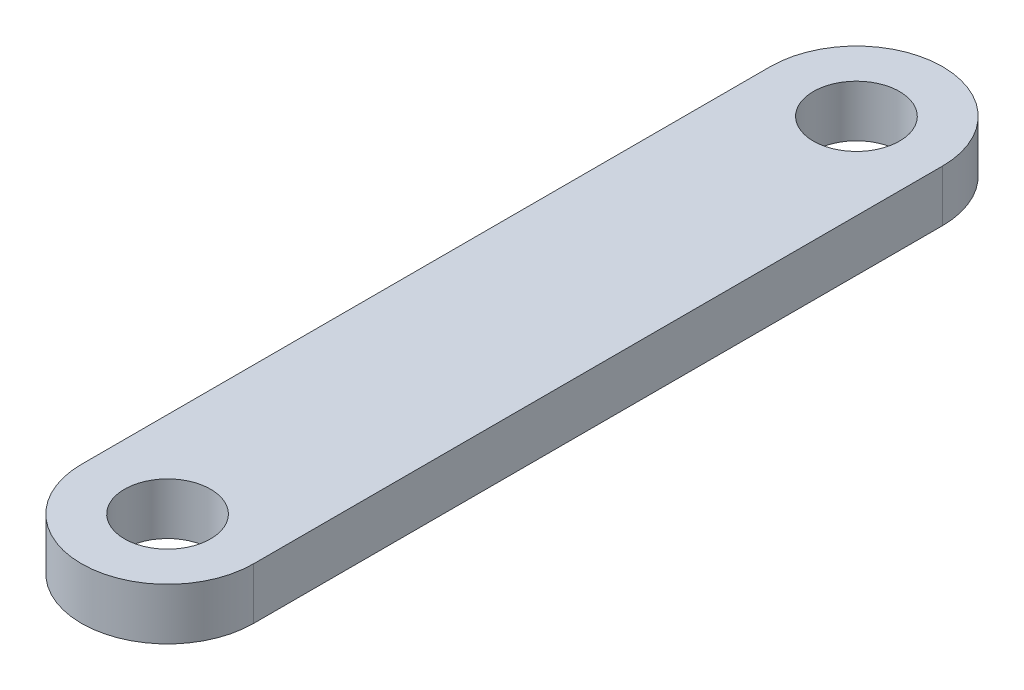
from build123d import *

# Parameters (mm, degrees)
BOSS_EXTRUDE1_DEPTH = 12
SKETCH4_R           = 10
CUT_EXTRUDE1_DEPTH  = 30
SKETCH3_R           = 10
CUT_EXTRUDE2_DEPTH  = 30


with BuildPart() as part:
    # Sketch2 → Boss-Extrude1 (new body)
    with BuildSketch(Plane(origin=(0, 0, 0), x_dir=(1, 0, 0), z_dir=(0, 1, 0))):
        with BuildLine():
            Line((-20, 0), (-20, 160))
            ThreePointArc((-20, 160), (0, 180), (20, 160))
            Line((20, 160), (20, 0))
            ThreePointArc((20, 0), (0, -20), (-20, 0))
        make_face()
    extrude(amount=BOSS_EXTRUDE1_DEPTH)

    # Sketch4 → Cut-Extrude1 (cut)
    with BuildSketch(Plane(origin=(0, 12, 0), x_dir=(1, 0, 0), z_dir=(0, 1, 0))):
        with Locations(Location((0, 160, 0), (0, 0, 270))):
            Circle(SKETCH4_R)
    extrude(amount=-CUT_EXTRUDE1_DEPTH, mode=Mode.SUBTRACT)

    # Sketch3 → Cut-Extrude2 (cut)
    with BuildSketch(Plane(origin=(0, 12, 0), x_dir=(1, 0, 0), z_dir=(0, 1, 0))):
        with Locations(Location((0, 0, 0), (0, 0, 270))):
            Circle(SKETCH3_R)
    extrude(amount=-CUT_EXTRUDE2_DEPTH, mode=Mode.SUBTRACT)


solid = part.part
